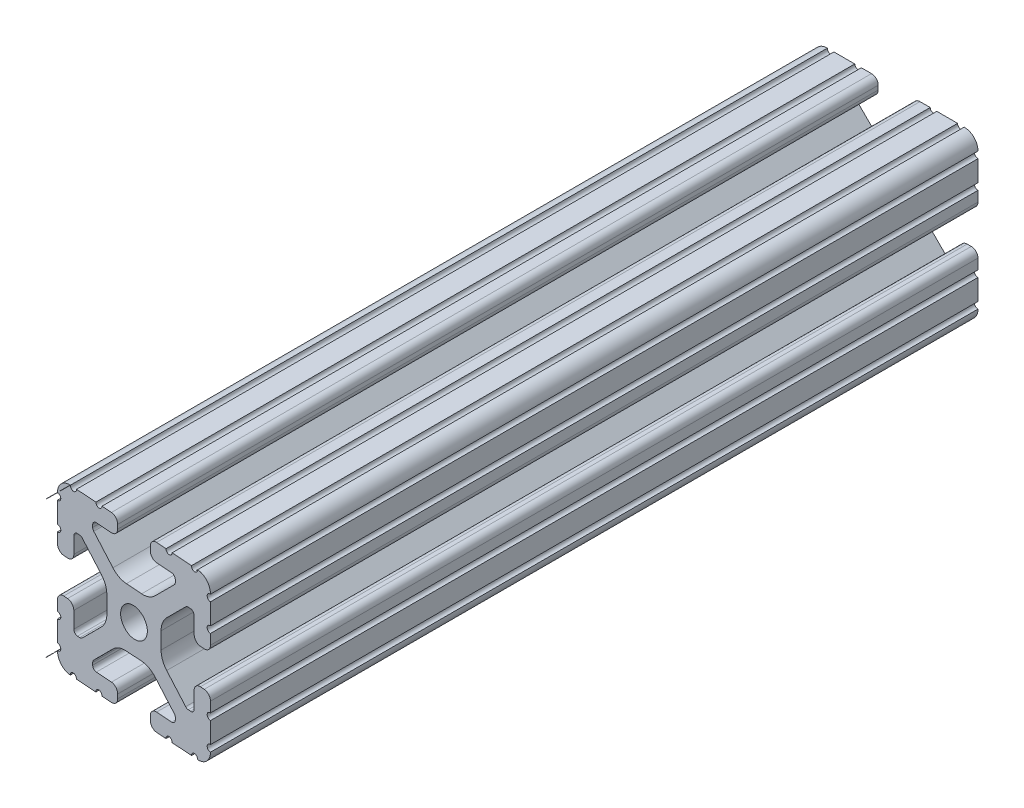
from build123d import *

# Parameters (mm, degrees)
SKETCH1_R          = 3.3274
EXTRUDE1_DEPTH     = 177.8
CUT_EXTRUDE1_DEPTH = 183.83152419


with BuildPart() as part:
    # Sketch1 → Extrude1 (new body)
    with BuildSketch(Plane.XY):
        with BuildLine():
            Line((-10.022898969, 12.91475973), (-5.252158105, 8.144007132))
            ThreePointArc((-5.252158105, 8.144007132), (-3.715177372, 7.117027388), (-1.902183975, 6.7564))
            Line((-1.902183975, 6.7564), (1.902183975, 6.7564))
            ThreePointArc((1.902183975, 6.7564), (3.715177372, 7.117027388), (5.252158105, 8.144007132))
            Line((5.252158105, 8.144007132), (10.022898969, 12.91475973))
            ThreePointArc((10.022898969, 12.91475973), (10.218362387, 13.207291992), (10.287, 13.552357131))
            Line((10.287, 13.552357131), (10.287, 14.0843))
            ThreePointArc((10.287, 14.0843), (10.022898185, 14.721898185), (9.3853, 14.986))
            Line((9.3853, 14.986), (5.617617549, 14.986))
            ThreePointArc((5.617617549, 14.986), (4.519044045, 15.441044045), (4.064, 16.539617549))
            Line((4.064, 16.539617549), (4.064, 17.496382451))
            ThreePointArc((4.064, 17.496382451), (4.519044045, 18.594955955), (5.617617549, 19.05))
            Line((5.617617549, 19.05), (7.974178704, 19.05))
            ThreePointArc((7.974178704, 19.05), (8.736178704, 18.288), (9.498178704, 19.05))
            Line((9.498178704, 19.05), (14.327719207, 19.05))
            ThreePointArc((14.327719207, 19.05), (15.087603123, 18.231251131), (15.847487039, 19.05))
            ThreePointArc((15.847487039, 19.05), (18.120176289, 18.120192083), (19.05, 15.847509295))
            ThreePointArc((19.05, 15.847509295), (18.231250992, 15.08762539), (19.05, 14.327741484))
            Line((19.05, 14.327741484), (19.05, 9.496091471))
            ThreePointArc((19.05, 9.496091471), (18.231250992, 8.736207565), (19.05, 7.97632366))
            Line((19.05, 7.97632366), (19.05, 5.617617549))
            ThreePointArc((19.05, 5.617617549), (18.594955955, 4.519044045), (17.496382451, 4.064))
            Line((17.496382451, 4.064), (16.539617549, 4.064))
            ThreePointArc((16.539617549, 4.064), (15.441044045, 4.519044045), (14.986, 5.617617549))
            Line((14.986, 5.617617549), (14.986, 9.385342516))
            ThreePointArc((14.986, 9.385342516), (14.721898185, 10.022940701), (14.0843, 10.287042516))
            Line((14.0843, 10.287042516), (13.516042086, 10.287042516))
            ThreePointArc((13.516042086, 10.287042516), (13.170975923, 10.218404478), (12.878443117, 10.022939917))
            Line((12.878443117, 10.022939917), (8.14758008, 5.292065243))
            ThreePointArc((8.14758008, 5.292065243), (7.117955879, 3.751120653), (6.7564, 1.933453584))
            Line((6.7564, 1.933453584), (6.7564, -1.933453584))
            ThreePointArc((6.7564, -1.933453584), (7.117955879, -3.751120653), (8.14758008, -5.292065243))
            Line((8.14758008, -5.292065243), (12.878443117, -10.022939917))
            ThreePointArc((12.878443117, -10.022939917), (13.170975923, -10.218404478), (13.516042086, -10.287042516))
            Line((13.516042086, -10.287042516), (14.0843, -10.287042516))
            ThreePointArc((14.0843, -10.287042516), (14.721898185, -10.022940701), (14.986, -9.385342516))
            Line((14.986, -9.385342516), (14.986, -5.617617549))
            ThreePointArc((14.986, -5.617617549), (15.441044045, -4.519044045), (16.539617549, -4.064))
            Line((16.539617549, -4.064), (17.496382451, -4.064))
            ThreePointArc((17.496382451, -4.064), (18.594955955, -4.519044045), (19.05, -5.617617549))
            Line((19.05, -5.617617549), (19.05, -7.976318491))
            ThreePointArc((19.05, -7.976318491), (18.231250992, -8.736202396), (19.05, -9.496086302))
            Line((19.05, -9.496086302), (19.05, -14.32774291))
            ThreePointArc((19.05, -14.32774291), (18.231250992, -15.087626816), (19.05, -15.847510721))
            ThreePointArc((19.05, -15.847510721), (18.120175716, -18.120192644), (15.847486868, -19.05))
            ThreePointArc((15.847486868, -19.05), (15.087602952, -18.231251131), (14.327719036, -19.05))
            Line((14.327719036, -19.05), (9.496062448, -19.05))
            ThreePointArc((9.496062448, -19.05), (8.736178532, -18.231251131), (7.976294616, -19.05))
            Line((7.976294616, -19.05), (5.617617549, -19.05))
            ThreePointArc((5.617617549, -19.05), (4.519044045, -18.594955955), (4.064, -17.496382451))
            Line((4.064, -17.496382451), (4.064, -16.539617549))
            ThreePointArc((4.064, -16.539617549), (4.519044045, -15.441044045), (5.617617549, -14.986))
            Line((5.617617549, -14.986), (9.3853, -14.986))
            ThreePointArc((9.3853, -14.986), (10.022898185, -14.721898185), (10.287, -14.0843))
            Line((10.287, -14.0843), (10.287, -13.552357131))
            ThreePointArc((10.287, -13.552357131), (10.218362387, -13.207291992), (10.022898969, -12.91475973))
            Line((10.022898969, -12.91475973), (5.252158105, -8.144007132))
            ThreePointArc((5.252158105, -8.144007132), (3.715177372, -7.117027388), (1.902183975, -6.7564))
            Line((1.902183975, -6.7564), (-1.902183975, -6.7564))
            ThreePointArc((-1.902183975, -6.7564), (-3.715177372, -7.117027388), (-5.252158105, -8.144007132))
            Line((-5.252158105, -8.144007132), (-10.022898969, -12.91475973))
            ThreePointArc((-10.022898969, -12.91475973), (-10.218362387, -13.207291992), (-10.287, -13.552357131))
            Line((-10.287, -13.552357131), (-10.287, -14.0843))
            ThreePointArc((-10.287, -14.0843), (-10.022898185, -14.721898185), (-9.3853, -14.986))
            Line((-9.3853, -14.986), (-5.617617549, -14.986))
            ThreePointArc((-5.617617549, -14.986), (-4.519044045, -15.441044045), (-4.064, -16.539617549))
            Line((-4.064, -16.539617549), (-4.064, -17.496382451))
            ThreePointArc((-4.064, -17.496382451), (-4.519044045, -18.594955955), (-5.617617549, -19.05))
            Line((-5.617617549, -19.05), (-7.976294616, -19.05))
            ThreePointArc((-7.976294616, -19.05), (-8.736178532, -18.231251131), (-9.496062448, -19.05))
            Line((-9.496062448, -19.05), (-14.327719036, -19.05))
            ThreePointArc((-14.327719036, -19.05), (-15.087602952, -18.231251131), (-15.847486868, -19.05))
            ThreePointArc((-15.847486868, -19.05), (-18.120175716, -18.120192644), (-19.05, -15.847510721))
            ThreePointArc((-19.05, -15.847510721), (-18.231250992, -15.087626816), (-19.05, -14.32774291))
            Line((-19.05, -14.32774291), (-19.05, -9.496086302))
            ThreePointArc((-19.05, -9.496086302), (-18.231250992, -8.736202396), (-19.05, -7.976318491))
            Line((-19.05, -7.976318491), (-19.05, -5.617617549))
            ThreePointArc((-19.05, -5.617617549), (-18.594955955, -4.519044045), (-17.496382451, -4.064))
            Line((-17.496382451, -4.064), (-16.539617549, -4.064))
            ThreePointArc((-16.539617549, -4.064), (-15.441044045, -4.519044045), (-14.986, -5.617617549))
            Line((-14.986, -5.617617549), (-14.986, -9.385342516))
            ThreePointArc((-14.986, -9.385342516), (-14.721898185, -10.022940701), (-14.0843, -10.287042516))
            Line((-14.0843, -10.287042516), (-13.516042086, -10.287042516))
            ThreePointArc((-13.516042086, -10.287042516), (-13.170975923, -10.218404478), (-12.878443117, -10.022939917))
            Line((-12.878443117, -10.022939917), (-8.14758008, -5.292065243))
            ThreePointArc((-8.14758008, -5.292065243), (-7.117955879, -3.751120653), (-6.7564, -1.933453584))
            Line((-6.7564, -1.933453584), (-6.7564, 1.933453584))
            ThreePointArc((-6.7564, 1.933453584), (-7.117955879, 3.751120653), (-8.14758008, 5.292065243))
            Line((-8.14758008, 5.292065243), (-12.878443117, 10.022939917))
            ThreePointArc((-12.878443117, 10.022939917), (-13.170975923, 10.218404478), (-13.516042086, 10.287042516))
            Line((-13.516042086, 10.287042516), (-14.0843, 10.287042516))
            ThreePointArc((-14.0843, 10.287042516), (-14.721898185, 10.022940701), (-14.986, 9.385342516))
            Line((-14.986, 9.385342516), (-14.986, 5.617617549))
            ThreePointArc((-14.986, 5.617617549), (-15.441044045, 4.519044045), (-16.539617549, 4.064))
            Line((-16.539617549, 4.064), (-17.496382451, 4.064))
            ThreePointArc((-17.496382451, 4.064), (-18.594955955, 4.519044045), (-19.05, 5.617617549))
            Line((-19.05, 5.617617549), (-19.05, 7.97632366))
            ThreePointArc((-19.05, 7.97632366), (-18.231250992, 8.736207565), (-19.05, 9.496091471))
            Line((-19.05, 9.496091471), (-19.05, 14.327741484))
            ThreePointArc((-19.05, 14.327741484), (-18.231250992, 15.08762539), (-19.05, 15.847509295))
            ThreePointArc((-19.05, 15.847509295), (-18.120176289, 18.120192083), (-15.847487039, 19.05))
            ThreePointArc((-15.847487039, 19.05), (-15.087603123, 18.231251131), (-14.327719207, 19.05))
            Line((-14.327719207, 19.05), (-9.498178704, 19.05))
            ThreePointArc((-9.498178704, 19.05), (-8.736178704, 18.288), (-7.974178704, 19.05))
            Line((-7.974178704, 19.05), (-5.617617549, 19.05))
            ThreePointArc((-5.617617549, 19.05), (-4.519044045, 18.594955955), (-4.064, 17.496382451))
            Line((-4.064, 17.496382451), (-4.064, 16.539617549))
            ThreePointArc((-4.064, 16.539617549), (-4.519044045, 15.441044045), (-5.617617549, 14.986))
            Line((-5.617617549, 14.986), (-9.3853, 14.986))
            ThreePointArc((-9.3853, 14.986), (-10.022898185, 14.721898185), (-10.287, 14.0843))
            Line((-10.287, 14.0843), (-10.287, 13.552357131))
            ThreePointArc((-10.287, 13.552357131), (-10.218362387, 13.207291992), (-10.022898969, 12.91475973))
        make_face()
        Circle(SKETCH1_R, mode=Mode.SUBTRACT)
    extrude(amount=-EXTRUDE1_DEPTH)

    # Sketch2 → Cut-Extrude1 (cut, through all)
    with BuildSketch(Plane(origin=(0, 19.05, 0), x_dir=(1, 0, 0), z_dir=(0, 1, 0))):
        Polygon((19.05, 0), (-19.05, 2.664211535), (-19.05, 0), align=None)
    extrude(amount=-CUT_EXTRUDE1_DEPTH, mode=Mode.SUBTRACT)


solid = part.part
